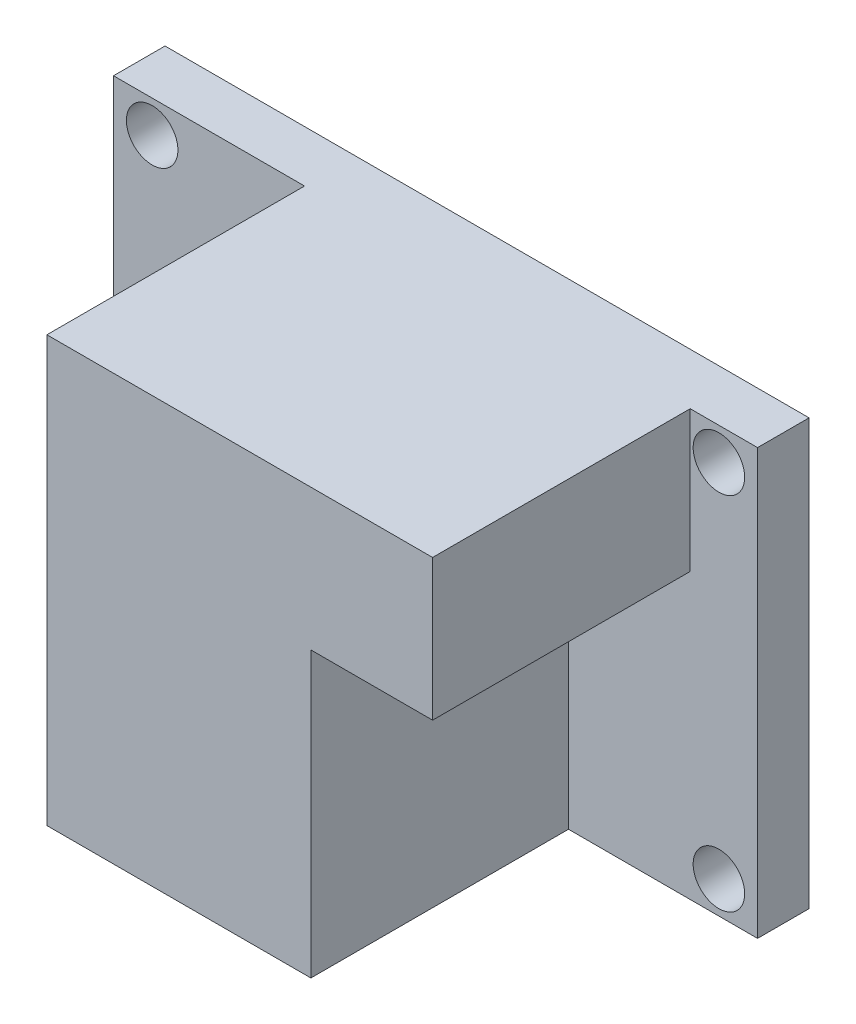
from build123d import *

# Parameters (mm, degrees)
SKETCH1_W           = 50
SKETCH1_H           = 33
SKETCH1_R           = 2
BOSS_EXTRUDE1_DEPTH = 4
BOSS_EXTRUDE2_DEPTH = 24


with BuildPart() as part:
    # Sketch1 → Boss-Extrude1 (new body)
    with BuildSketch(Plane.XY):
        with Locations((25, 16.5)):
            Rectangle(SKETCH1_W, SKETCH1_H)
        with Locations((3, 2.5)):
            Circle(SKETCH1_R, mode=Mode.SUBTRACT)
        with Locations((3, 30.5)):
            Circle(SKETCH1_R, mode=Mode.SUBTRACT)
        with Locations((47, 2.5)):
            Circle(SKETCH1_R, mode=Mode.SUBTRACT)
        with Locations((47, 30.5)):
            Circle(SKETCH1_R, mode=Mode.SUBTRACT)
    extrude(amount=BOSS_EXTRUDE1_DEPTH)

    # Sketch1<3> → Boss-Extrude2 (add)
    with BuildSketch(Plane.XY):
        Polygon((14.829713536, 33), (14.829713536, 0), (35.322939572, 0), (35.322939572, 22.058501613), (44.771529769, 22.058501613), (44.771529769, 33), align=None)
    extrude(amount=BOSS_EXTRUDE2_DEPTH)


solid = part.part
